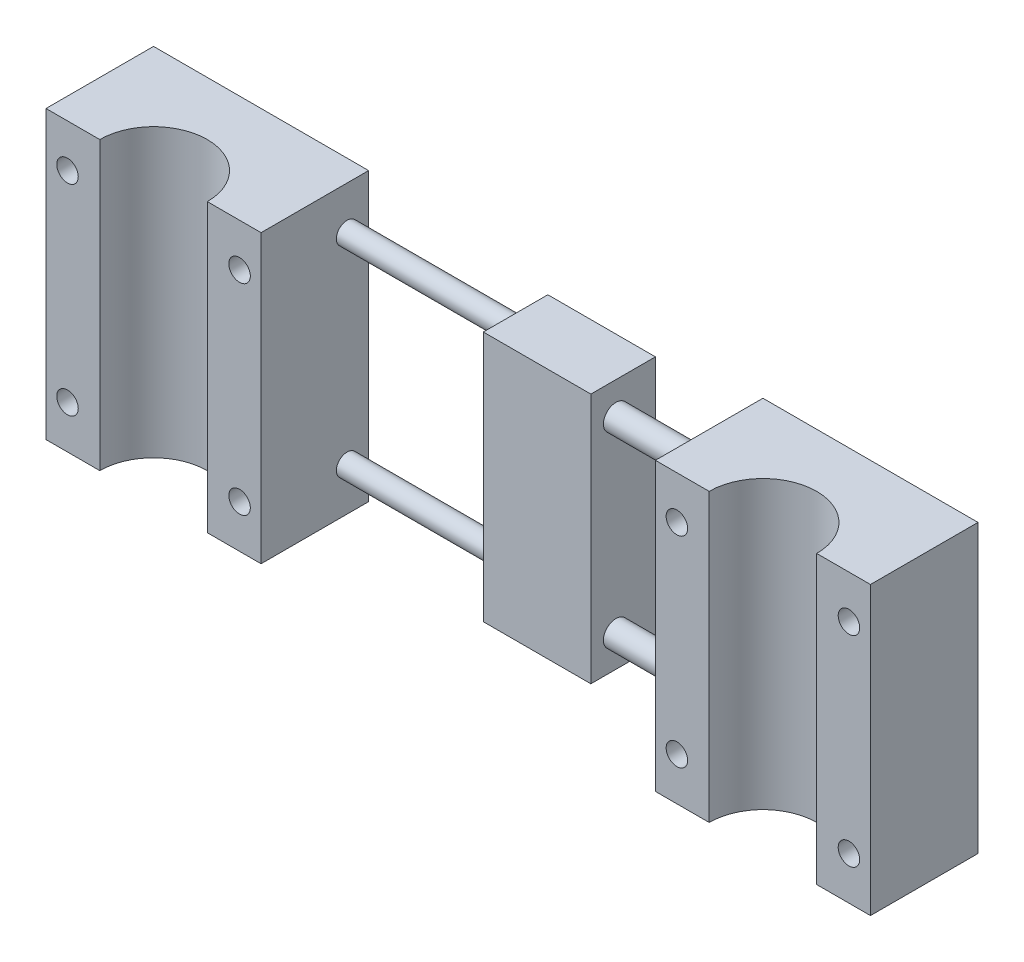
from build123d import *

# Parameters (mm, degrees)
SKETCH1_W           = 30
SKETCH1_H           = 40
BOSS_EXTRUDE1_DEPTH = 15
CUT_EXTRUDE1_DEPTH  = 49
SKETCH3_R           = 1.5
CUT_EXTRUDE2_DEPTH  = 49
SKETCH4_R           = 1.5
BOSS_EXTRUDE2_DEPTH = 25
SKETCH5_W           = 9
SKETCH5_H           = 35
BOSS_EXTRUDE3_DEPTH = 15
SKETCH6_R           = 1.75
BOSS_EXTRUDE4_DEPTH = 15
SKETCH7_W           = 15
SKETCH7_H           = 40
BOSS_EXTRUDE6_DEPTH = 30
CUT_EXTRUDE3_DEPTH  = 59
SKETCH10_R          = 1.5
CUT_EXTRUDE4_DEPTH  = 59


with BuildPart() as part:
    # Sketch1 → Boss-Extrude1 (new body)
    with BuildSketch(Plane.XY):
        with Locations((15, 20)):
            Rectangle(SKETCH1_W, SKETCH1_H)
    extrude(amount=BOSS_EXTRUDE1_DEPTH)

    # Sketch2 → Cut-Extrude1 (cut)
    with BuildSketch(Plane(origin=(0, 40, 0), x_dir=(1, 0, 0), z_dir=(0, 1, 0))):
        with BuildLine():
            Line((7.5, -15), (22.5, -15))
            ThreePointArc((22.5, -15), (15, -7.5), (7.5, -15))
        make_face()
    extrude(amount=-CUT_EXTRUDE1_DEPTH, mode=Mode.SUBTRACT)

    # Sketch3 → Cut-Extrude2 (cut)
    with BuildSketch(Plane.XY.offset(15)):
        with Locations((3, 34)):
            Circle(SKETCH3_R)
        with Locations((3, 6)):
            Circle(SKETCH3_R)
        with Locations((27, 34)):
            Circle(SKETCH3_R)
        with Locations((27, 6)):
            Circle(SKETCH3_R)
    extrude(amount=-CUT_EXTRUDE2_DEPTH, mode=Mode.SUBTRACT)

    # Sketch4 → Boss-Extrude2 (add)
    with BuildSketch(Plane(origin=(30, 0, 0), x_dir=(0, 0, -1), z_dir=(1, 0, 0))):
        with Locations(Location((-3, 34, 0), (0, 0, 180))):
            Circle(SKETCH4_R)
        with Locations(Location((-3, 6, 0), (0, 0, 180))):
            Circle(SKETCH4_R)
    extrude(amount=BOSS_EXTRUDE2_DEPTH)

    # Sketch5 → Boss-Extrude3 (add)
    with BuildSketch(Plane(origin=(55, 0, 0), x_dir=(0, 0, -1), z_dir=(1, 0, 0))):
        with Locations((-4.5, 20)):
            Rectangle(SKETCH5_W, SKETCH5_H)
    extrude(amount=BOSS_EXTRUDE3_DEPTH)

    # Sketch6 → Boss-Extrude4 (add)
    with BuildSketch(Plane(origin=(70, 0, 0), x_dir=(0, 0, -1), z_dir=(1, 0, 0))):
        with Locations(Location((-5.5, 33, 0), (0, 0, 180))):
            Circle(SKETCH6_R)
        with Locations(Location((-5.5, 6.887482194, 0), (0, 0, 180))):
            Circle(SKETCH6_R)
    extrude(amount=BOSS_EXTRUDE4_DEPTH)

    # Sketch7 → Boss-Extrude6 (add)
    with BuildSketch(Plane(origin=(85, 0, 0), x_dir=(0, 0, -1), z_dir=(1, 0, 0))):
        with Locations((-7.5, 20)):
            Rectangle(SKETCH7_W, SKETCH7_H)
    extrude(amount=BOSS_EXTRUDE6_DEPTH)

    # Sketch9 → Cut-Extrude3 (cut)
    with BuildSketch(Plane(origin=(0, 40, 0), x_dir=(1, 0, 0), z_dir=(0, 1, 0))):
        with BuildLine():
            Line((92.5, -15), (107.5, -15))
            ThreePointArc((107.5, -15), (100, -7.5), (92.5, -15))
        make_face()
    extrude(amount=-CUT_EXTRUDE3_DEPTH, mode=Mode.SUBTRACT)

    # Sketch10 → Cut-Extrude4 (cut)
    with BuildSketch(Plane.XY.offset(15)):
        with Locations((88, 34)):
            Circle(SKETCH10_R)
        with Locations((112, 34)):
            Circle(SKETCH10_R)
        with Locations((112, 6)):
            Circle(SKETCH10_R)
        with Locations((88, 6)):
            Circle(SKETCH10_R)
    extrude(amount=-CUT_EXTRUDE4_DEPTH, mode=Mode.SUBTRACT)


solid = part.part
